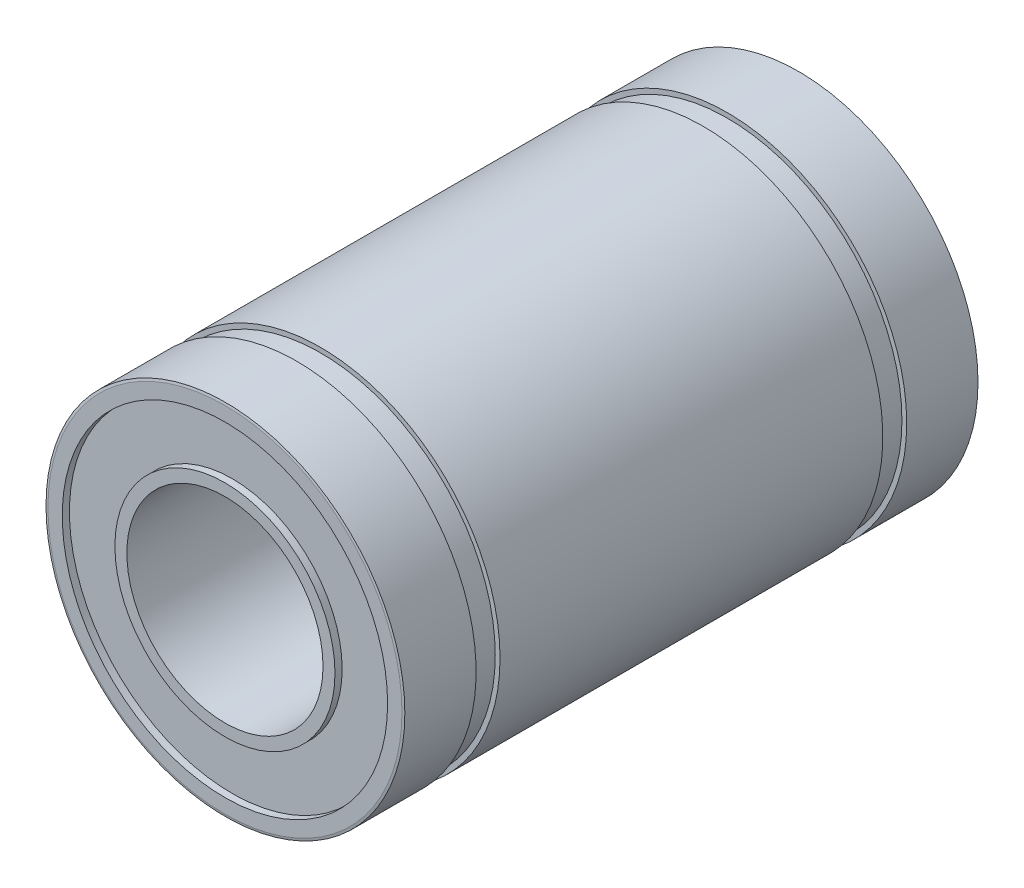
from build123d import *

# Parameters (mm, degrees)
CROQUIS1_R              = 7.5
CROQUIS1_R_2            = 4.1
SALIENTE_EXTRUIR1_DEPTH = 24
CROQUIS2_W              = 0.4
CROQUIS2_H              = 1


with BuildPart() as part:
    # Croquis1 → Saliente-Extruir1 (new body)
    with BuildSketch(Plane.XY):
        Circle(CROQUIS1_R)
        Circle(CROQUIS1_R_2, mode=Mode.SUBTRACT)
    extrude(amount=SALIENTE_EXTRUIR1_DEPTH)

    # Croquis2 → Cortar-Revolución1 (revolve, cut)
    with BuildSketch(Plane(origin=(0, 0, 0), x_dir=(1, 0, 0), z_dir=(0, 1, 0)), mode=Mode.PRIVATE) as cortar_revoluci_n1_sk:
        Polygon((-7.5, -0.02), (-7.4, 0), (-6.8, 0), (-6.8, -0.3), (-4.6, -0.3), (-4.6, 0), (-4.1, 0), (-4.1, 0.7), (-7.5, 0.7), align=None)
        Polygon((-7.5, -24.7), (-7.5, -23.98), (-7.4, -24), (-6.8, -24), (-6.8, -23.7), (-4.6, -23.7), (-4.6, -24), (-4.1, -24), (-4.1, -24.7), align=None)
        with Locations((-7.5, -3.5)):
            Rectangle(CROQUIS2_W, CROQUIS2_H)
        with Locations((-7.5, -20.5)):
            Rectangle(CROQUIS2_W, CROQUIS2_H)
    revolve(cortar_revoluci_n1_sk.sketch.rotate(Axis((0, 0, 24), (0, 0, -1)), 180), axis=Axis((0, 0, 24), (0, 0, -1)), mode=Mode.SUBTRACT)


solid = part.part
